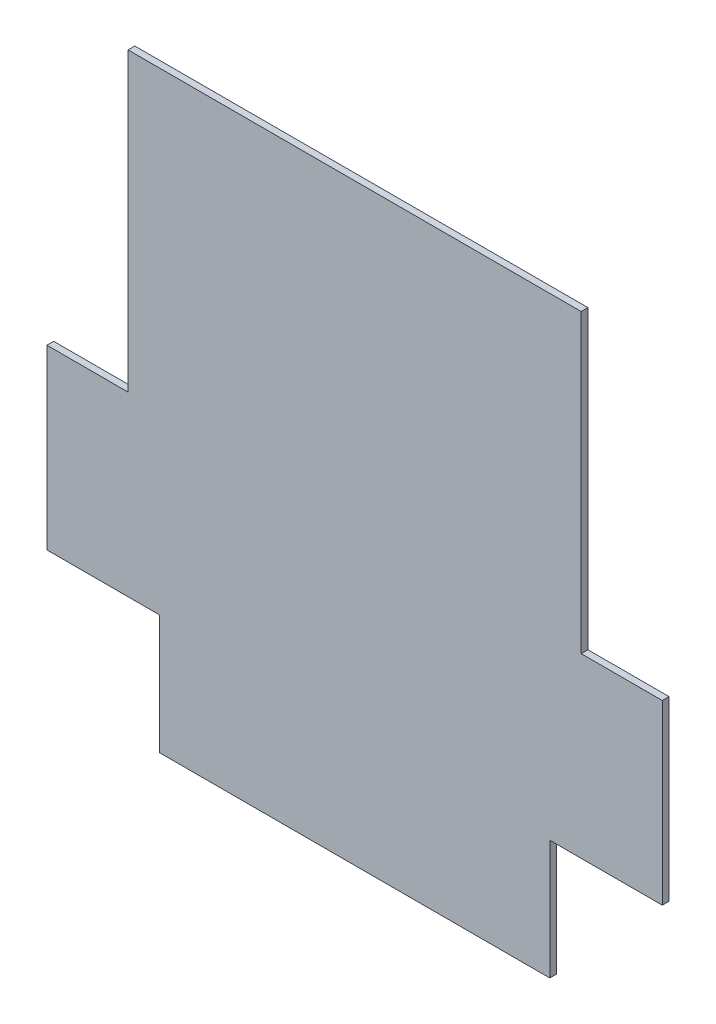
from build123d import *

# Parameters (mm, degrees)
SKETCH1_W           = 273.4
SKETCH1_H           = 263.4
BOSS_EXTRUDE1_DEPTH = 3
SKETCH2_W           = 36.05
SKETCH2_H           = 131.64
SKETCH2_W_2         = 50
SKETCH2_H_2         = 53
CUT_EXTRUDE1_DEPTH  = 380.652630703


with BuildPart() as part:
    # Sketch1 → Boss-Extrude1 (new body)
    with BuildSketch(Plane.XY):
        with Locations((136.7, -131.7)):
            Rectangle(SKETCH1_W, SKETCH1_H)
    extrude(amount=BOSS_EXTRUDE1_DEPTH)

    # Sketch2 → Cut-Extrude1 (cut, through all)
    with BuildSketch(Plane.XY.offset(3)):
        with Locations((18.025, -65.82)):
            Rectangle(SKETCH2_W, SKETCH2_H)
        with Locations((25, -236.9)):
            Rectangle(SKETCH2_W_2, SKETCH2_H_2)
        with Locations((255.375, -65.82)):
            Rectangle(SKETCH2_W, SKETCH2_H)
        with Locations((248.4, -236.9)):
            Rectangle(SKETCH2_W_2, SKETCH2_H_2)
    extrude(amount=-CUT_EXTRUDE1_DEPTH, mode=Mode.SUBTRACT)


solid = part.part
